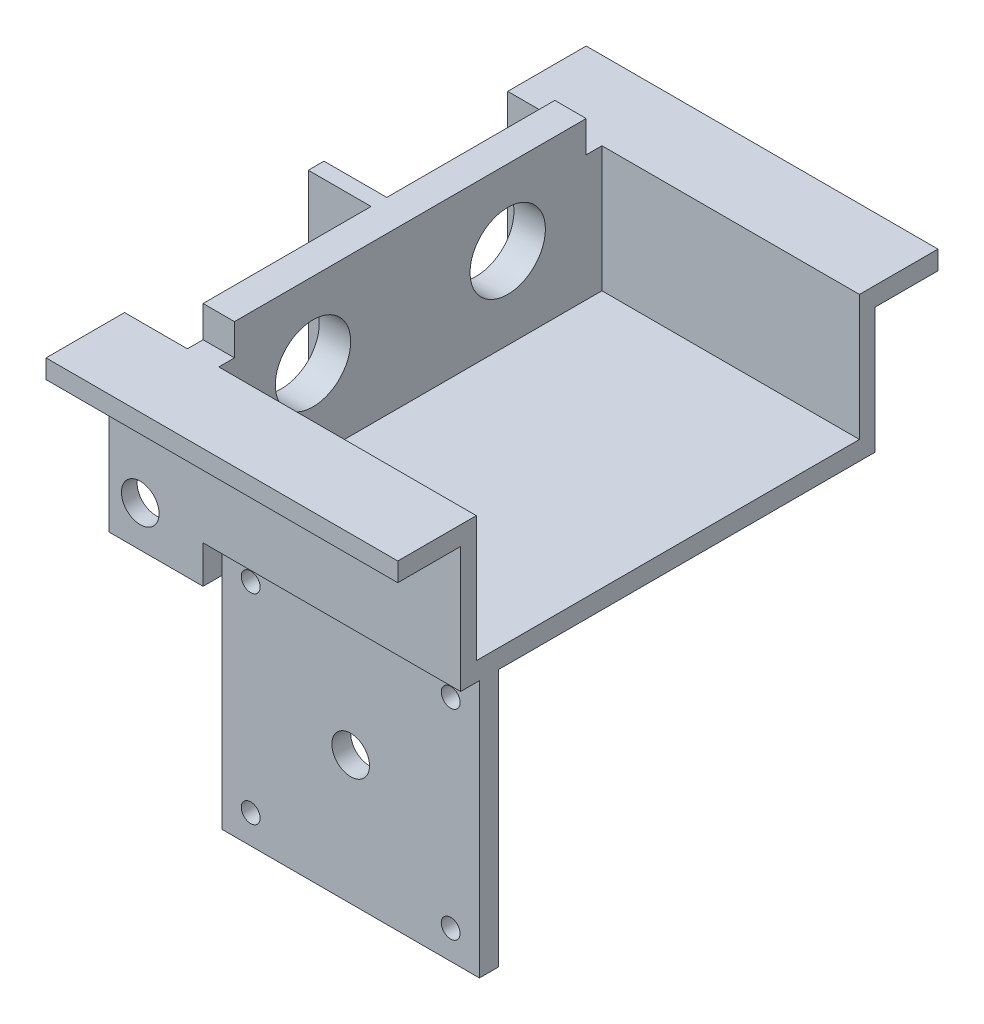
from build123d import *

# Parameters (mm, degrees)
SKETCH1_R               = 6
BOSS_EXTRUDE1_DEPTH     = 5
SKETCH1_W               = 66
SKETCH1_H               = 6
BOSS_EXTRUDE1_2_DEPTH   = 5
SKETCH1_4_W             = 2.5
SKETCH1_4_H             = 34
BOSS_EXTRUDE2_DEPTH     = 10
CUT_EXTRUDE1_DEPTH      = 51.418870475
CUT_EXTRUDE1_DEPTH_BACK = 51.418870475
SKETCH2_R               = 3
BOSS_EXTRUDE3_DEPTH     = 46
SKETCH3_W               = 41
SKETCH3_H               = 3
BOSS_EXTRUDE4_DEPTH     = 41
SKETCH4_R               = 3
SKETCH4_R_2             = 1.5
CUT_EXTRUDE2_DEPTH      = 6


with BuildPart() as part:
    # Sketch1 → Boss-Extrude1 (new body)
    with BuildSketch(Plane(origin=(0, 0, 0), x_dir=(0, 0, -1), z_dir=(1, 0, 0))):
        Polygon((-28, 12), (-28, 7), (-30.5, 7), (-30.5, -13), (30.5, -13), (30.5, 7), (28, 7), (28, 12), align=None)
        with Locations((-15.5, 0)):
            Circle(SKETCH1_R, mode=Mode.SUBTRACT)
        with Locations((15.5, 0)):
            Circle(SKETCH1_R, mode=Mode.SUBTRACT)
    extrude(amount=BOSS_EXTRUDE1_DEPTH)

    # Sketch1<4> → Boss-Extrude2 (add)
    with BuildSketch(Plane(origin=(0, 0, 0), x_dir=(0, 0, -1), z_dir=(1, 0, 0))):
        with Locations((0, -5)):
            Rectangle(SKETCH1_4_W, SKETCH1_4_H)
        Polygon((-33, 4), (-33, -22), (-30.5, -22), (-30.5, 7), (-43, 7), (-43, 4), align=None)
        Polygon((30.5, -22), (33, -22), (33, 4), (43, 4), (43, 7), (30.5, 7), align=None)
    extrude(amount=-BOSS_EXTRUDE2_DEPTH)


with BuildPart() as body_2:
    # Sketch1 → Boss-Extrude1 2 (new body)
    with BuildSketch(Plane(origin=(0, 0, 0), x_dir=(0, 0, -1), z_dir=(1, 0, 0))):
        with Locations((0, -19)):
            Rectangle(SKETCH1_W, SKETCH1_H)
    extrude(amount=BOSS_EXTRUDE1_2_DEPTH)



with BuildPart() as boss_extrude2_piece_1:
    # of the separate pieces the step leaves, piece 1, a body of its own (boss_extrude2_pieces)
    add(part.part.solids().sort_by_distance((0, 7, -28))[0])


with BuildPart() as boss_extrude2_piece_2:
    # of the separate pieces the step leaves, piece 2, a body of its own (boss_extrude2_pieces)
    add(part.part.solids().sort_by_distance((0, -22, 30.5))[0])


with BuildPart() as boss_extrude2_piece_3:
    # of the separate pieces the step leaves, piece 3, a body of its own (boss_extrude2_pieces)
    add(part.part.solids().sort_by_distance((-10, 7, -30.5))[0])


with BuildPart() as cut_extrude1_tool:
    # Sketch2 → Cut-Extrude1 (new, two sides: drawn at the far end of the back side and taken through both)
    with BuildSketch(Plane.XY.offset(1.25).offset(-CUT_EXTRUDE1_DEPTH_BACK)):
        with Locations((-5, -15.5)):
            Circle(SKETCH2_R)
    extrude(amount=CUT_EXTRUDE1_DEPTH + CUT_EXTRUDE1_DEPTH_BACK)


with BuildPart() as boss_extrude2_piece_1_1:
    add(boss_extrude2_piece_1.part)

    # Cut-Extrude1: cut by cut_extrude1_tool
    add(cut_extrude1_tool.part, mode=Mode.SUBTRACT)


with BuildPart() as boss_extrude2_piece_2_1:
    add(boss_extrude2_piece_2.part)

    # Cut-Extrude1: cut by cut_extrude1_tool
    add(cut_extrude1_tool.part, mode=Mode.SUBTRACT)


with BuildPart() as boss_extrude2_piece_3_1:
    add(boss_extrude2_piece_3.part)

    # Cut-Extrude1: cut by cut_extrude1_tool
    add(cut_extrude1_tool.part, mode=Mode.SUBTRACT)


with BuildPart() as body_2_1:
    add(body_2.part)

    add(boss_extrude2_piece_1_1.part)  # Boss-Extrude3 merges Boss-Extrude2 piece 1

    add(boss_extrude2_piece_2_1.part)  # Boss-Extrude3 merges Boss-Extrude2 piece 2

    add(boss_extrude2_piece_3_1.part)  # Boss-Extrude3 merges Boss-Extrude2 piece 3
    # Sketch1<6> → Boss-Extrude3 (add)
    with BuildSketch(Plane(origin=(0, 0, 0), x_dir=(0, 0, -1), z_dir=(1, 0, 0))):
        Polygon((-30.5, -13), (-30.5, 7), (-43, 7), (-43, 4), (-33, 4), (-33, -16), (33, -16), (33, 4), (43, 4), (43, 7), (30.5, 7), (30.5, -13), align=None)
    extrude(amount=BOSS_EXTRUDE3_DEPTH)

    # Sketch3 → Boss-Extrude4 (add)
    with BuildSketch(Plane.XZ.offset(16)):
        with Locations((25.5, 28.5)):
            Rectangle(SKETCH3_W, SKETCH3_H)
    extrude(amount=BOSS_EXTRUDE4_DEPTH)

    # Sketch4 → Cut-Extrude2 (cut)
    with BuildSketch(Plane(origin=(0, 0, 27), x_dir=(-1, 0, 0), z_dir=(0, 0, -1))):
        with Locations((-25.5, -36.5)):
            Circle(SKETCH4_R)
        with Locations((-41.42, -20.58)):
            Circle(SKETCH4_R_2)
        with Locations((-9.58, -20.58)):
            Circle(SKETCH4_R_2)
        with Locations((-9.58, -52.42)):
            Circle(SKETCH4_R_2)
        with Locations((-41.42, -52.42)):
            Circle(SKETCH4_R_2)
    extrude(amount=-CUT_EXTRUDE2_DEPTH, mode=Mode.SUBTRACT)


solid = body_2_1.part
